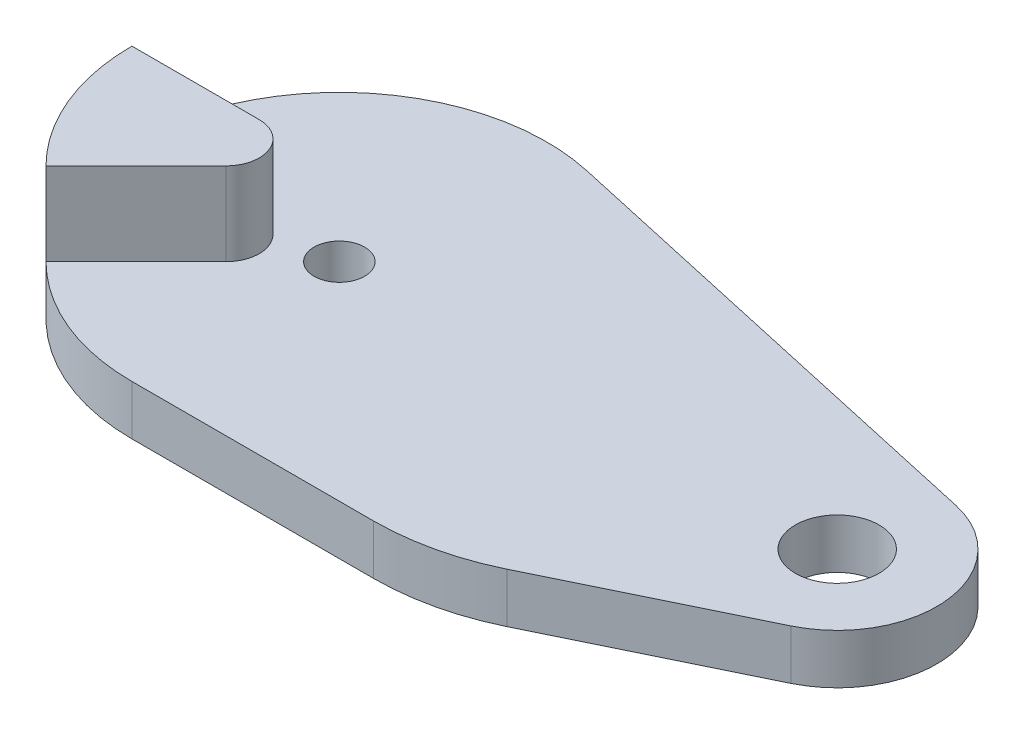
from build123d import *

# Parameters (mm, degrees)
SKETCH_1_R          = 12.5
SKETCH_1_R_2        = 3.05
EXTRUDE_1_DEPTH     = 8
SKETCH_2_R          = 1.6
CUT_EXTRUDE_4_DEPTH = 12.5
SKETCH_3_R          = 5.05
EXTRUDE_2_DEPTH     = 6
SKETCH_4_R          = 18
EXTRUDE_3_DEPTH     = 2
FILLET_2_R          = 30
FILLET_1_R          = 1
EXTRUDE_4_DEPTH     = 10
FILLET_3_R          = 4
SKETCH_6_R          = 3.05
CUT_EXTRUDE_5_DEPTH = 14
CUT_EXTRUDE_6_REACH = 81.906


with BuildPart() as part:
    # 草图1 → 凸台-拉伸1 (new body)
    with BuildSketch(Plane(origin=(0, 0, 0), x_dir=(1, 0, 0), z_dir=(0, 1, 0))):
        with Locations(Location((0, 0, 0), (0, 0, 270))):
            Circle(SKETCH_1_R)
        with Locations(Location((0, 0, 0), (0, 0, 270))):
            Circle(SKETCH_1_R_2, mode=Mode.SUBTRACT)
    extrude(amount=EXTRUDE_1_DEPTH)

    # 草图2 → 切除-拉伸4 (cut, symmetric)
    with BuildSketch(Plane.XY):
        with Locations((0, 3.3)):
            Circle(SKETCH_2_R)
    extrude(amount=CUT_EXTRUDE_4_DEPTH, both=True, mode=Mode.SUBTRACT)

    # 草图3 → 凸台-拉伸2 (add)
    with BuildSketch(Plane(origin=(0, 8, 0), x_dir=(1, 0, 0), z_dir=(0, 1, 0))):
        with BuildLine():
            Line((5.416666667, 24.406141076), (62.6, 11.714947716))
            ThreePointArc((62.6, 11.714947716), (71.918087828, 1.399708015), (65.243514508, -10.793773928))
            Line((65.243514508, -10.793773928), (36, -25))
            Line((36, -25), (0, -25))
            ThreePointArc((0, -25), (-24.851091796, 2.724561717), (5.416666667, 24.406141076))
        make_face()
        with Locations(Location((60, 0, 0), (0, 0, 270))):
            Circle(SKETCH_3_R, mode=Mode.SUBTRACT)
    extrude(amount=EXTRUDE_2_DEPTH)

    # 草图4 → 凸台-拉伸3 (add)
    with BuildSketch(Plane.XZ.offset(-8)):
        with Locations(Location((0, 0, 0), (0, 0, 90))):
            Circle(SKETCH_4_R)
    extrude(amount=EXTRUDE_3_DEPTH)

    # 圆角2
    fillet_2_edges = [part.edges().sort_by_distance(p)[0] for p in [
        (36, 11, 25),
    ]]
    fillet(fillet_2_edges, radius=FILLET_2_R)

    # 圆角1
    fillet_1_edges = [part.edges().sort_by_distance(p)[0] for p in [
        (0, 6, -18),
    ]]
    fillet(fillet_1_edges, radius=FILLET_1_R)

    # 草图5 → 凸台-拉伸4 (add)
    with BuildSketch(Plane(origin=(0, 14, 0), x_dir=(1, 0, 0), z_dir=(0, 1, 0))):
        with BuildLine():
            Line((0, 0), (-25, 0))
            ThreePointArc((-25, 0), (-23.096988313, -9.567085809), (-17.67766953, -17.67766953))
            Line((-17.67766953, -17.67766953), (0, 0))
        make_face()
    extrude(amount=EXTRUDE_4_DEPTH)

    # 圆角3
    fillet_3_edges = [part.edges().sort_by_distance(p)[0] for p in [
        (0, 19, 0),
    ]]
    fillet(fillet_3_edges, radius=FILLET_3_R)

    # 草图6 → 切除-拉伸5 (cut)
    with BuildSketch(Plane.XZ):
        with Locations(Location((0, 0, 0), (0, 0, 90))):
            Circle(SKETCH_6_R)
    extrude(amount=-CUT_EXTRUDE_5_DEPTH, mode=Mode.SUBTRACT)

    # 切除-拉伸6: up to this face of the body (flat: up to its plane)
    cut_extrude_6_end = Plane(part.part.faces().sort_by_distance((0, 6, -16.519167389))[0])
    # 草图8 → 切除-拉伸6 (cut, up to the picked face)
    with BuildSketch(Plane.XZ, mode=Mode.PRIVATE) as cut_extrude_6_sk1:
        with BuildLine():
            ThreePointArc((5.937171044, 11), (0, 12.5), (-5.937171044, 11))
            Line((-5.937171044, 11), (5.937171044, 11))
        make_face()
    cut_extrude_6_tool1 = split(extrude(cut_extrude_6_sk1.sketch, amount=-CUT_EXTRUDE_6_REACH, mode=Mode.PRIVATE), bisect_by=cut_extrude_6_end, keep=Keep.BOTH, mode=Mode.PRIVATE)
    # 草图8 → 切除-拉伸6 (cut, up to the picked face)
    with BuildSketch(Plane.XZ, mode=Mode.PRIVATE) as cut_extrude_6_sk2:
        with BuildLine():
            Line((5.937171044, -11), (-5.937171044, -11))
            ThreePointArc((-5.937171044, -11), (0, -12.5), (5.937171044, -11))
        make_face()
    cut_extrude_6_tool2 = split(extrude(cut_extrude_6_sk2.sketch, amount=-CUT_EXTRUDE_6_REACH, mode=Mode.PRIVATE), bisect_by=cut_extrude_6_end, keep=Keep.BOTH, mode=Mode.PRIVATE)
    add(cut_extrude_6_tool1.solids().sort_by(Axis((0, 0, 11.603197), (0, 1, 0)))[0], mode=Mode.SUBTRACT)
    add(cut_extrude_6_tool2.solids().sort_by(Axis((0, 0, -11.603197), (0, 1, 0)))[0], mode=Mode.SUBTRACT)


solid = part.part
